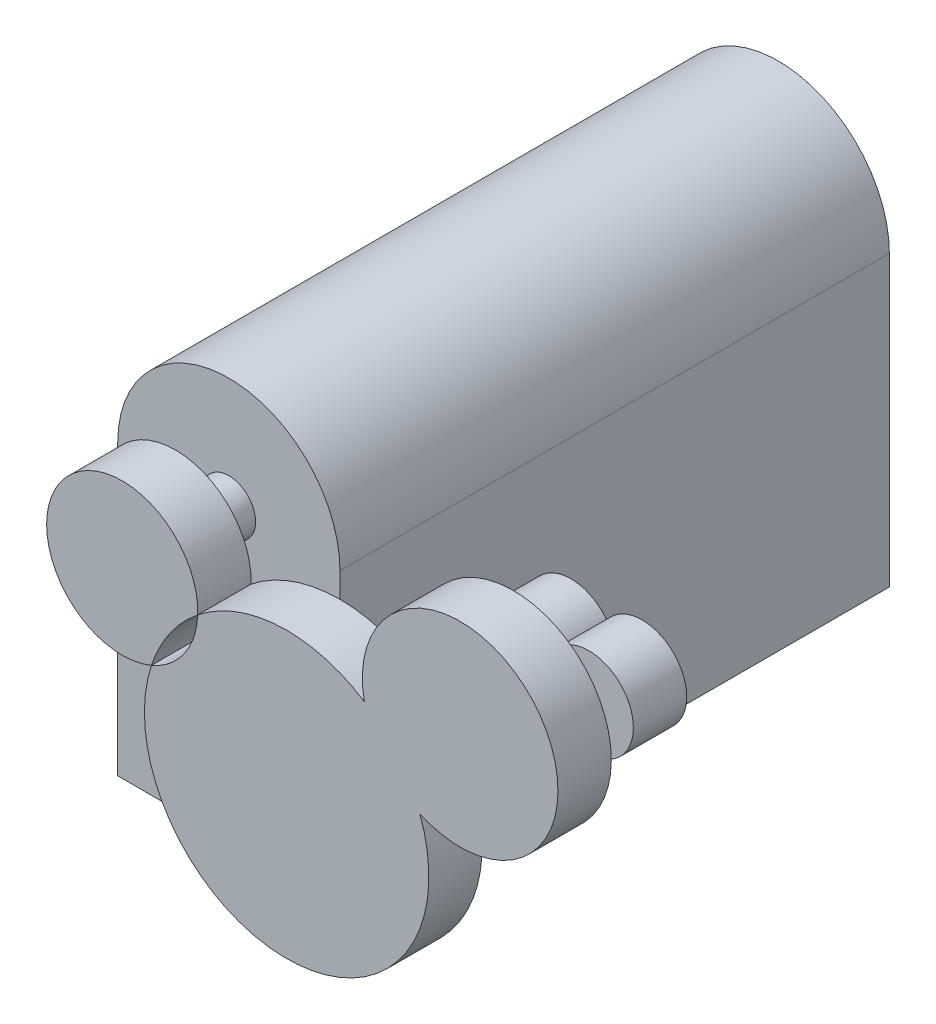
from build123d import *

# Parameters (mm, degrees)
BOSS_EXTRUDE7_DEPTH  = 30.9
SKETCH7_R            = 1.5
BOSS_EXTRUDE8_DEPTH  = 3
BOSS_EXTRUDE9_DEPTH  = 3
SKETCH9_R            = 1
BOSS_EXTRUDE10_DEPTH = 11.773049601
BOSS_EXTRUDE11_DEPTH = 3


with BuildPart() as part:
    # Sketch6 → Boss-Extrude7 (new body)
    with BuildSketch(Plane.XY):
        with BuildLine():
            Line((-6.25, 0), (-6.25, -16.25))
            Line((-6.25, -16.25), (6.25, -16.25))
            Line((6.25, -16.25), (6.25, 0))
            ThreePointArc((6.25, 0), (0, 6.25), (-6.25, 0))
        make_face()
    extrude(amount=-BOSS_EXTRUDE7_DEPTH)

    # Sketch7 → Boss-Extrude8 (add)
    with BuildSketch(Plane.XY):
        Circle(SKETCH7_R)
    extrude(amount=BOSS_EXTRUDE8_DEPTH)

    # Sketch8 → Boss-Extrude9 (add)
    with BuildSketch(Plane.XY.offset(3)):
        with BuildLine():
            ThreePointArc((4.246966167, -0.160556459), (-3.494444444, 2.418958045), (1.645626426, -3.918470833))
            ThreePointArc((1.645626426, -3.918470833), (2.672222222, -1.849791446), (4.246966167, -0.160556459))
        make_face()
        with BuildLine():
            ThreePointArc((4.246966167, -0.160556459), (3.494444444, -2.418958045), (1.645626426, -3.918470833))
            ThreePointArc((1.645626426, -3.918470833), (9.416028142, -14.401401218), (16.744714653, -3.605044132))
            ThreePointArc((16.744714653, -3.605044132), (23.304127047, 4.843275763), (13.623214853, 0.295755658))
            ThreePointArc((13.623214853, 0.295755658), (8.861125761, 1.587418724), (4.246966167, -0.160556459))
        make_face()
    extrude(amount=BOSS_EXTRUDE9_DEPTH)


with BuildPart() as boss_extrude9_piece_1:
    # of the separate pieces the step leaves, piece 1, a body of its own (boss_extrude9_pieces)
    add(part.part.solids().sort_by_distance((1.5, 0, 3))[0])


with BuildPart() as boss_extrude9_piece_2:
    # of the separate pieces the step leaves, piece 2, a body of its own (boss_extrude9_pieces)
    add(part.part.solids().sort_by_distance((13.623214853, 0.295755658, 3))[0])

    # Sketch9 → Boss-Extrude10 (add)
    with BuildSketch(Plane(origin=(0, 0, 3), x_dir=(-1, 0, 0), z_dir=(0, 0, -1))):
        with Locations(Location((-9.25, -6.403124237, 0), (0, 0, 180))):
            Circle(SKETCH9_R)
    extrude(amount=BOSS_EXTRUDE10_DEPTH)

    # Sketch10 → Boss-Extrude11 (add)
    with BuildSketch(Plane(origin=(0, 0, -7), x_dir=(-1, 0, 0), z_dir=(0, 0, -1))):
        with BuildLine():
            ThreePointArc((-11.25, -7.903124237), (-6.75, -6.403124237), (-11.25, -4.903124237))
            ThreePointArc((-11.25, -4.903124237), (-15.75, -6.403124237), (-11.25, -7.903124237))
        make_face()
    extrude(amount=BOSS_EXTRUDE11_DEPTH)


solid = Compound([boss_extrude9_piece_1.part, boss_extrude9_piece_2.part])
